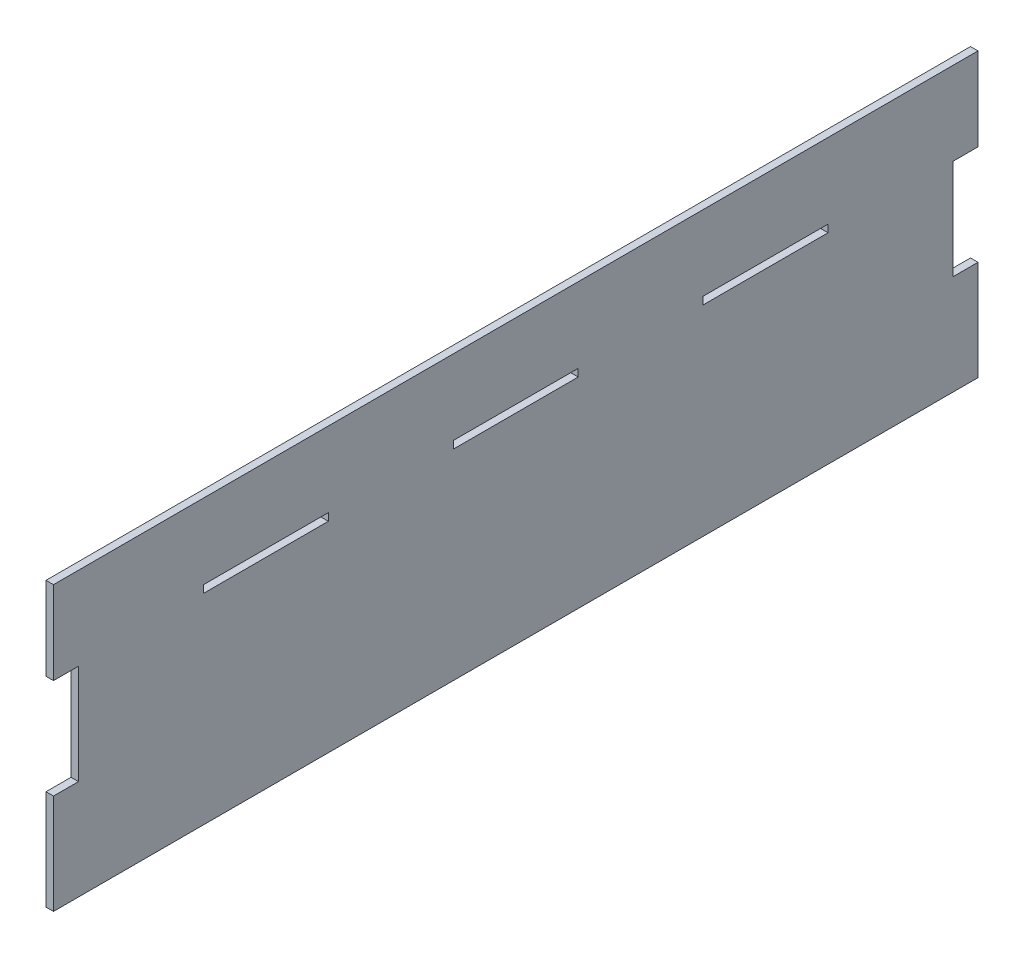
from build123d import *

# Parameters (mm, degrees)
SKETCH_1_W      = 50
SKETCH_1_H      = 3
EXTRUDE_1_DEPTH = 3


with BuildPart() as part:
    # 스케치1 → 보스-돌출1 (new body)
    with BuildSketch(Plane(origin=(0, 0, 0), x_dir=(0, 0, -1), z_dir=(1, 0, 0))):
        Polygon((185, 90.423529412), (-185, 90.423529412), (-185, 57.153529412), (-175, 57.153529412), (-175, 17.153529412), (-185, 17.153529412), (-185, -22.846470588), (185, -22.846470588), (185, 17.153529412), (175, 17.153529412), (175, 57.153529412), (185, 57.153529412), align=None)
        with Locations((-100, 58.883529412)):
            Rectangle(SKETCH_1_W, SKETCH_1_H, mode=Mode.SUBTRACT)
        with Locations((0, 58.883529412)):
            Rectangle(SKETCH_1_W, SKETCH_1_H, mode=Mode.SUBTRACT)
        with Locations((100, 58.883529412)):
            Rectangle(SKETCH_1_W, SKETCH_1_H, mode=Mode.SUBTRACT)
    extrude(amount=EXTRUDE_1_DEPTH)


solid = part.part
